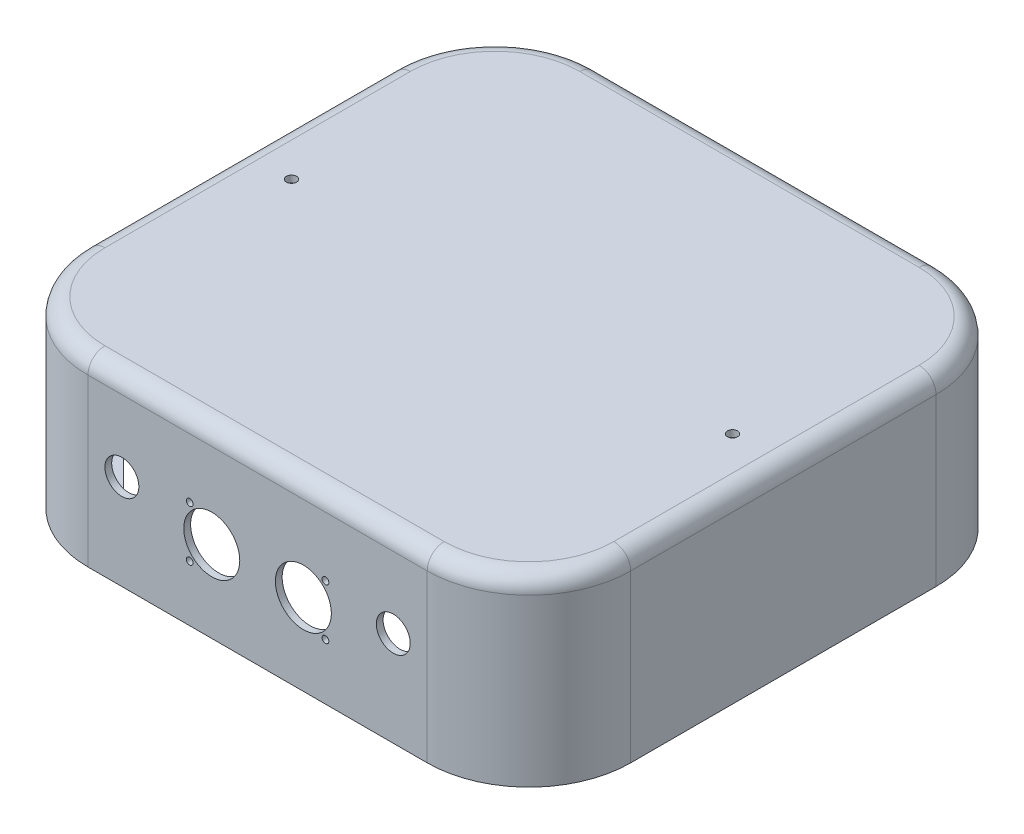
from build123d import *

# Parameters (mm, degrees)
SKETCH1_R           = 1.5
BOTTOM_DEPTH        = 2
BOTTOM_2_DEPTH      = 2
BOTTOM_3_DEPTH      = 2
BOTTOM_4_DEPTH      = 2
WALLS_DEPTH         = 50
TOP_DEPTH           = 2
SKETCH4_R           = 1
SKETCH4_R_2         = 8.25
CUT_EXTRUDE2_DEPTH  = 2
SKETCH5_R           = 5
CUT_EXTRUDE3_DEPTH  = 2
SKETCH6_R           = 3
CUT_EXTRUDE4_DEPTH  = 2
SKETCH8_R           = 1.5
CUT_EXTRUDE5_DEPTH  = 2
BOSS_EXTRUDE5_DEPTH = 2
FILLET1_R           = 5
CUT_EXTRUDE6_DEPTH  = 10


with BuildPart() as part:
    # Sketch1 → Bottom (new body)
    with BuildSketch(Plane(origin=(0, 0, 0), x_dir=(1, 0, 0), z_dir=(0, 1, 0))):
        with BuildLine():
            ThreePointArc((-80, -45), (-71.213203436, -66.213203436), (-50, -75))
            Line((-50, -75), (-39.513159642, -75))
            Line((-39.513159642, -75), (-80, -34.513159642))
            Line((-80, -34.513159642), (-80, -45))
        make_face()
        with Locations(Location((-63.62, -59.64375, 0), (0, 0, 270))):
            Circle(SKETCH1_R, mode=Mode.SUBTRACT)
    extrude(amount=BOTTOM_DEPTH)



with BuildPart() as body_2:
    # Sketch1 → Bottom 2 (new body)
    with BuildSketch(Plane(origin=(0, 0, 0), x_dir=(1, 0, 0), z_dir=(0, 1, 0))):
        with BuildLine():
            Line((-80, 45), (-80, 34.513159642))
            Line((-80, 34.513159642), (-39.513159642, 75))
            Line((-39.513159642, 75), (-50, 75))
            ThreePointArc((-50, 75), (-71.213203436, 66.213203436), (-80, 45))
        make_face()
        with Locations(Location((-63.62, 59.64375, 0), (0, 0, 270))):
            Circle(SKETCH1_R, mode=Mode.SUBTRACT)
    extrude(amount=BOTTOM_2_DEPTH)


with BuildPart() as body_3:
    # Sketch1 → Bottom 3 (new body)
    with BuildSketch(Plane(origin=(0, 0, 0), x_dir=(1, 0, 0), z_dir=(0, 1, 0))):
        with BuildLine():
            Line((39.513159642, 75), (80, 34.513159642))
            Line((80, 34.513159642), (80, 45))
            ThreePointArc((80, 45), (71.213203436, 66.213203436), (50, 75))
            Line((50, 75), (39.513159642, 75))
        make_face()
        with Locations(Location((63.62, 59.64375, 0), (0, 0, 270))):
            Circle(SKETCH1_R, mode=Mode.SUBTRACT)
    extrude(amount=BOTTOM_3_DEPTH)


with BuildPart() as body_4:
    # Sketch1 → Bottom 4 (new body)
    with BuildSketch(Plane(origin=(0, 0, 0), x_dir=(1, 0, 0), z_dir=(0, 1, 0))):
        with BuildLine():
            Line((80, -34.513159642), (39.513159642, -75))
            Line((39.513159642, -75), (50, -75))
            ThreePointArc((50, -75), (71.213203436, -66.213203436), (80, -45))
            Line((80, -45), (80, -34.513159642))
        make_face()
        with Locations(Location((63.62, -59.64375, 0), (0, 0, 270))):
            Circle(SKETCH1_R, mode=Mode.SUBTRACT)
    extrude(amount=BOTTOM_4_DEPTH)


with BuildPart() as part_1:
    add(part.part)

    add(body_2.part)  # Walls merges body 2

    add(body_3.part)  # Walls merges body 3

    add(body_4.part)  # Walls merges body 4
    # Sketch2 → Walls (add)
    with BuildSketch(Plane(origin=(0, 2, 0), x_dir=(1, 0, 0), z_dir=(0, 1, 0))):
        with BuildLine():
            Line((50, 75), (-50, 75))
            ThreePointArc((-50, 75), (-71.213203436, 66.213203436), (-80, 45))
            Line((-80, 45), (-80, -45))
            ThreePointArc((-80, -45), (-71.213203436, -66.213203436), (-50, -75))
            Line((-50, -75), (50, -75))
            ThreePointArc((50, -75), (71.213203436, -66.213203436), (80, -45))
            Line((80, -45), (80, 45))
            ThreePointArc((80, 45), (71.213203436, 66.213203436), (50, 75))
        make_face()
        with BuildLine():
            Line((-48, -73), (48, -73))
            ThreePointArc((48, -73), (69.213203436, -64.213203436), (78, -43))
            Line((78, -43), (78, 43))
            ThreePointArc((78, 43), (69.213203436, 64.213203436), (48, 73))
            Line((48, 73), (-48, 73))
            ThreePointArc((-48, 73), (-69.213203436, 64.213203436), (-78, 43))
            Line((-78, 43), (-78, -43))
            ThreePointArc((-78, -43), (-69.213203436, -64.213203436), (-48, -73))
        make_face(mode=Mode.SUBTRACT)
    extrude(amount=WALLS_DEPTH)

    # Sketch3 → Top (add)
    with BuildSketch(Plane(origin=(0, 52, 0), x_dir=(1, 0, 0), z_dir=(0, 1, 0))):
        with BuildLine():
            Line((50, -75), (-50, -75))
            ThreePointArc((-50, -75), (-71.213203436, -66.213203436), (-80, -45))
            Line((-80, -45), (-80, 45))
            ThreePointArc((-80, 45), (-71.213203436, 66.213203436), (-50, 75))
            Line((-50, 75), (50, 75))
            ThreePointArc((50, 75), (71.213203436, 66.213203436), (80, 45))
            Line((80, 45), (80, -45))
            ThreePointArc((80, -45), (71.213203436, -66.213203436), (50, -75))
        make_face()
    extrude(amount=TOP_DEPTH)

    # Sketch4 → Cut-Extrude2 (cut)
    with BuildSketch(Plane.XY.offset(75)):
        with Locations((-20, 16.5)):
            Circle(SKETCH4_R)
        with Locations((-13.5, 24)):
            Circle(SKETCH4_R_2)
        with Locations(Location((-20, 31.5, 0), (0, 0, 180))):
            Circle(SKETCH4_R)
        with Locations((20, 16.5)):
            Circle(SKETCH4_R)
        with Locations((13.5, 24)):
            Circle(SKETCH4_R_2)
        with Locations((20, 31.5)):
            Circle(SKETCH4_R)
    extrude(amount=-CUT_EXTRUDE2_DEPTH, mode=Mode.SUBTRACT)

    # Sketch5 → Cut-Extrude3 (cut)
    with BuildSketch(Plane.XY.offset(75)):
        with Locations((-40, 28)):
            Circle(SKETCH5_R)
        with Locations((40, 28)):
            Circle(SKETCH5_R)
    extrude(amount=-CUT_EXTRUDE3_DEPTH, mode=Mode.SUBTRACT)

    # Sketch6 → Cut-Extrude4 (cut)
    with BuildSketch(Plane(origin=(0, 0, -75), x_dir=(-1, 0, 0), z_dir=(0, 0, -1))):
        with Locations((-40, 34)):
            Circle(SKETCH6_R)
    extrude(amount=-CUT_EXTRUDE4_DEPTH, mode=Mode.SUBTRACT)

    # Sketch8 → Cut-Extrude5 (cut)
    with BuildSketch(Plane(origin=(0, 54, 0), x_dir=(1, 0, 0), z_dir=(0, 1, 0))):
        with Locations(Location((-65, 0, 0), (0, 0, 270))):
            Circle(SKETCH8_R)
        with Locations(Location((65, 0, 0), (0, 0, 90))):
            Circle(SKETCH8_R)
    extrude(amount=-CUT_EXTRUDE5_DEPTH, mode=Mode.SUBTRACT)

    # Sketch9 → Boss-Extrude5 (add)
    with BuildSketch(Plane.XZ.offset(-2)):
        Polygon((-80, 34.513159642), (-78, 36.513159642), (-78, -36.513159642), (-80, -34.513159642), align=None)
        Polygon((-39.513159642, 75), (-41.513159642, 73), (41.513159642, 73), (39.745521731, 74.76763791), (39.513159642, 75), align=None)
        Polygon((78, -36.513159642), (80, -34.513159642), (80, 34.513159642), (78, 36.513159642), align=None)
        Polygon((39.745521731, -74.76763791), (39.513159642, -75), (-39.513159642, -75), (-41.513159642, -73), (41.513159642, -73), align=None)
    extrude(amount=BOSS_EXTRUDE5_DEPTH)

    # Fillet1
    fillet1_edges = [part_1.edges().sort_by_distance(p)[0] for p in [
        (-71.213203436, 54, 66.213203436),
        (0, 54, 75),
        (71.213203436, 54, 66.213203436),
        (80, 54, 0),
        (71.213203436, 54, -66.213203436),
        (0, 54, -75),
        (-71.213203436, 54, -66.213203436),
        (-80, 54, 0),
    ]]
    fillet(fillet1_edges, radius=FILLET1_R)

    # Sketch10 → Cut-Extrude6 (cut)
    with BuildSketch(Plane(origin=(0, 0, -75), x_dir=(-1, 0, 0), z_dir=(0, 0, -1))):
        with BuildLine():
            Line((6.5, 5), (-6.5, 5))
            ThreePointArc((-6.5, 5), (-7.207106781, 5.292893219), (-7.5, 6))
            Line((-7.5, 6), (-7.5, 12))
            ThreePointArc((-7.5, 12), (-7.207106781, 12.707106781), (-6.5, 13))
            Line((-6.5, 13), (6.5, 13))
            ThreePointArc((6.5, 13), (7.207106781, 12.707106781), (7.5, 12))
            Line((7.5, 12), (7.5, 6))
            ThreePointArc((7.5, 6), (7.207106781, 5.292893219), (6.5, 5))
        make_face()
    extrude(amount=-CUT_EXTRUDE6_DEPTH, mode=Mode.SUBTRACT)


solid = part_1.part
